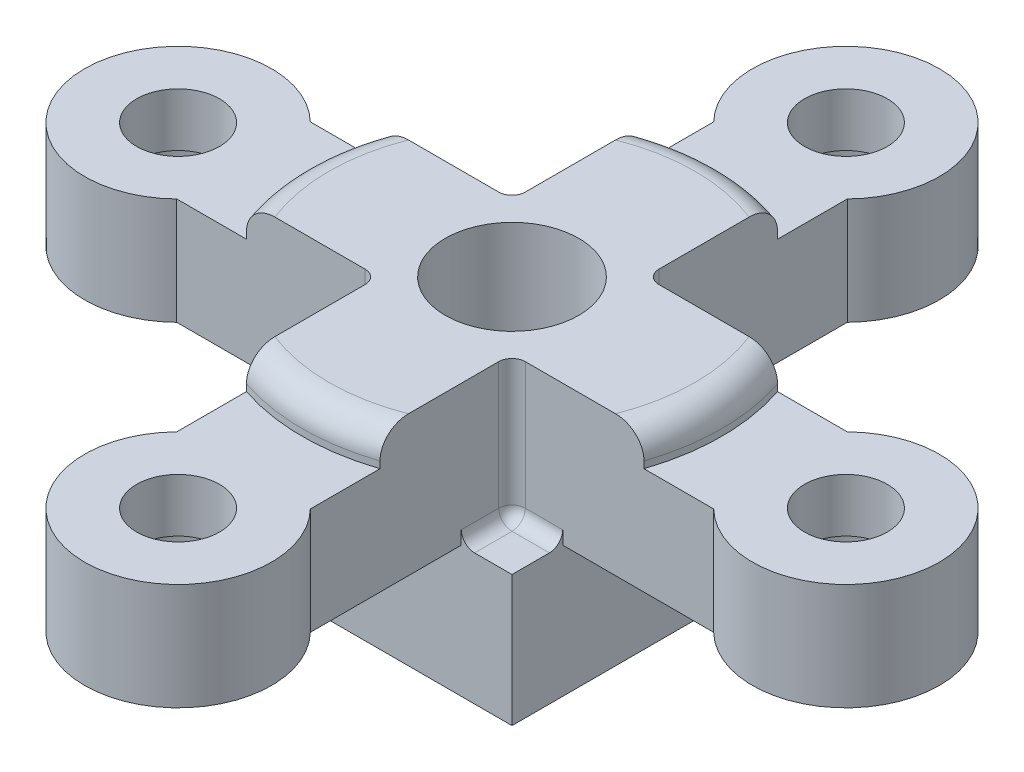
from build123d import *

# Parameters (mm, degrees)
BOSS_EXTRUDE1_DEPTH = 8
SKETCH2_R           = 7
BOSS_EXTRUDE2_DEPTH = 8
SKETCH3_R           = 3.1
CUT_EXTRUDE1_DEPTH  = 8
SKETCH4_R           = 5.05
CUT_EXTRUDE4_DEPTH  = 4
BOSS_EXTRUDE3_DEPTH = 2.5
SKETCH6_W           = 17.6
SKETCH6_H           = 17.6
BOSS_EXTRUDE4_DEPTH = 9.8
SKETCH7_R           = 5
CUT_EXTRUDE5_DEPTH  = 20.3
FILLET1_R           = 2
FILLET3_R           = 1


with BuildPart() as part:
    # Sketch1 → Boss-Extrude1 (new body)
    with BuildSketch(Plane(origin=(0, 0, 0), x_dir=(1, 0, 0), z_dir=(0, 1, 0))):
        Polygon((-5, 5), (-5, 25), (5, 25), (5, 5), (25, 5), (25, -5), (5, -5), (5, -25), (-5, -25), (-5, -5), (-25, -5), (-25, 5), align=None)
    extrude(amount=BOSS_EXTRUDE1_DEPTH)

    # Sketch2 → Boss-Extrude2 (add)
    with BuildSketch(Plane(origin=(0, 8, 0), x_dir=(1, 0, 0), z_dir=(0, 1, 0))):
        with Locations((25, 0)):
            Circle(SKETCH2_R)
        with Locations((0, -25)):
            Circle(SKETCH2_R)
        with Locations((-25, 0)):
            Circle(SKETCH2_R)
        with Locations((0, 25)):
            Circle(SKETCH2_R)
    extrude(amount=-BOSS_EXTRUDE2_DEPTH)

    # Sketch3 → Cut-Extrude1 (cut)
    with BuildSketch(Plane(origin=(0, 8, 0), x_dir=(1, 0, 0), z_dir=(0, 1, 0))):
        with Locations(Location((25, 0, 0), (0, 0, 270))):
            Circle(SKETCH3_R)
        with Locations(Location((0, -25, 0), (0, 0, 270))):
            Circle(SKETCH3_R)
        with Locations(Location((-25, 0, 0), (0, 0, 270))):
            Circle(SKETCH3_R)
        with Locations(Location((0, 25, 0), (0, 0, 270))):
            Circle(SKETCH3_R)
    extrude(amount=-CUT_EXTRUDE1_DEPTH, mode=Mode.SUBTRACT)

    # Sketch4 → Cut-Extrude4 (cut)
    with BuildSketch(Plane(origin=(0, 0, 0), x_dir=(1, 0, 0), z_dir=(0, 1, 0))):
        with Locations(Location((25, 0, 0), (0, 0, 270))):
            Circle(SKETCH4_R)
        with Locations(Location((0, -25, 0), (0, 0, 270))):
            Circle(SKETCH4_R)
        with Locations(Location((-25, 0, 0), (0, 0, 270))):
            Circle(SKETCH4_R)
        with Locations(Location((0, 25, 0), (0, 0, 270))):
            Circle(SKETCH4_R)
    extrude(amount=CUT_EXTRUDE4_DEPTH, mode=Mode.SUBTRACT)

    # Sketch5 → Boss-Extrude3 (add)
    with BuildSketch(Plane(origin=(0, 8, 0), x_dir=(1, 0, 0), z_dir=(0, 1, 0))):
        with BuildLine():
            Line((5, 5), (5, 14.882540106))
            ThreePointArc((5, 14.882540106), (0, 15.7), (-5, 14.882540106))
            Line((-5, 14.882540106), (-5, 5))
            Line((-5, 5), (-14.882540106, 5))
            ThreePointArc((-14.882540106, 5), (-15.7, 0), (-14.882540106, -5))
            Line((-14.882540106, -5), (-5, -5))
            Line((-5, -5), (-5, -14.882540106))
            ThreePointArc((-5, -14.882540106), (0, -15.7), (5, -14.882540106))
            Line((5, -14.882540106), (5, -5))
            Line((5, -5), (14.882540106, -5))
            ThreePointArc((14.882540106, -5), (15.7, 0), (14.882540106, 5))
            Line((14.882540106, 5), (5, 5))
        make_face()
    extrude(amount=BOSS_EXTRUDE3_DEPTH)

    # Sketch6 → Boss-Extrude4 (add)
    with BuildSketch(Plane.XZ):
        Rectangle(SKETCH6_W, SKETCH6_H)
    extrude(amount=BOSS_EXTRUDE4_DEPTH)

    # Sketch7 → Cut-Extrude5 (cut)
    with BuildSketch(Plane(origin=(0, 10.5, 0), x_dir=(1, 0, 0), z_dir=(0, 1, 0))):
        with Locations(Location((0, 0, 0), (0, 0, 270))):
            Circle(SKETCH7_R)
    extrude(amount=-CUT_EXTRUDE5_DEPTH, mode=Mode.SUBTRACT)

    # Fillet1
    fillet1_edges = [part.edges().sort_by_distance(p)[0] for p in [
        (0, 10.5, -15.7),
        (-15.7, 10.5, 0),
        (0, 10.5, 15.7),
        (15.7, 10.5, 0),
    ]]
    fillet(fillet1_edges, radius=FILLET1_R)

    # Fillet3
    fillet3_edges = [part.edges().sort_by_distance(p)[0] for p in [
        (6.9, 0, 5),
        (-5, 0, 6.9),
        (-6.9, 0, -5),
        (5, 0, -6.9),
        (-5, 0, -6.9),
        (6.9, 0, -5),
        (5, 0, 6.9),
        (-6.9, 0, 5),
        (5, 5.25, 5),
        (-5, 5.25, 5),
        (-5, 5.25, -5),
        (5, 5.25, -5),
    ]]
    fillet(fillet3_edges, radius=FILLET3_R)


solid = part.part
